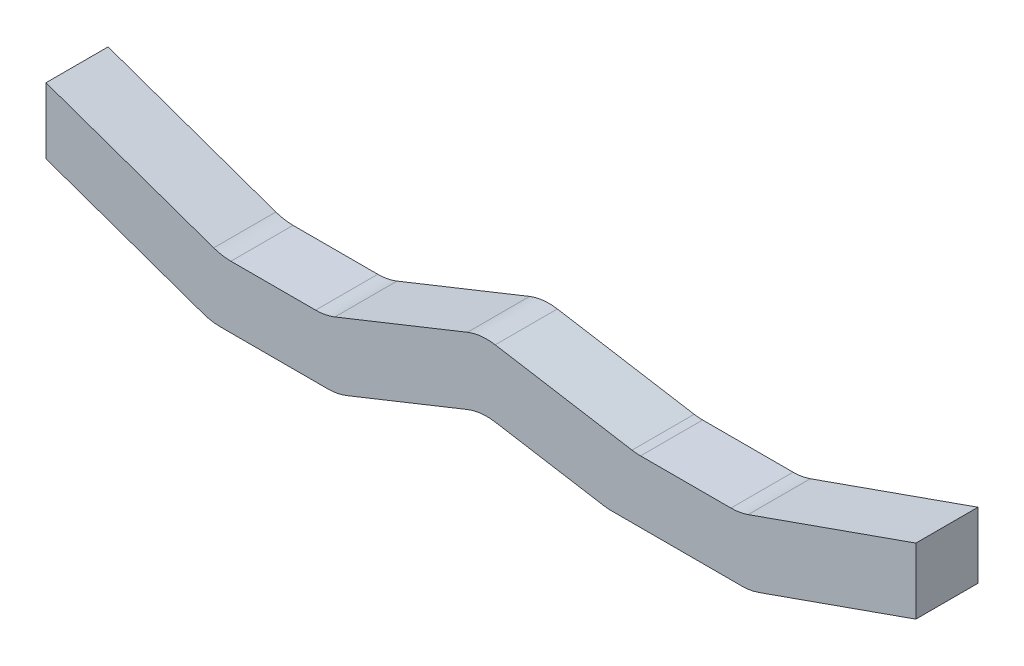
from build123d import *

# Parameters (mm, degrees)
BOSS_EXTRUDE1_DEPTH              = 19.05
F_1_8_0_125_DIAMETER_HOLE1_D     = 3.175
F_1_8_0_125_DIAMETER_HOLE1_DEPTH = 11.1252
F_1_8_0_125_DIAMETER_HOLE1_TIP   = 0.953866233
FILLET1_R                        = 15.875
F_1_8_0_125_DIAMETER_HOLE2_D     = 3.175
F_1_8_0_125_DIAMETER_HOLE2_DEPTH = 11.1252
F_1_8_0_125_DIAMETER_HOLE2_TIP   = 0.953866233
F_1_8_0_125_DIAMETER_HOLE3_D     = 3.175
F_1_8_0_125_DIAMETER_HOLE3_DEPTH = 11.1252
F_1_8_0_125_DIAMETER_HOLE3_TIP   = 0.953866233


with BuildPart() as part:
    # Sketch1 → Boss-Extrude1 (new body)
    with BuildSketch(Plane.XY):
        Polygon((0, 0), (47.625, -7.9375), (79.375, -7.9375), (133.35, 11.1125), (133.35, -9.089191705), (82.638126498, -26.9875), (38.820132509, -26.9875), (0, -20.517477915), (-43.956305212, -38.1), (-82.638126498, -38.1), (-133.35, -20.201691705), (-133.35, 0), (-79.375, -19.05), (-47.625, -19.05), align=None)
    extrude(amount=BOSS_EXTRUDE1_DEPTH)

    # 1/8 (0.125) Diameter Hole1
    with Locations(Plane(origin=(0, 0, 0), x_dir=(-1, 0, 0), z_dir=(0, 0, -1))):
        with Locations((-120.65, -3.470698794), (0, -10.258738958), (120.65, -14.583198794)):
            Hole(F_1_8_0_125_DIAMETER_HOLE1_D / 2, depth=F_1_8_0_125_DIAMETER_HOLE1_DEPTH)
            with Locations((0, 0, -(F_1_8_0_125_DIAMETER_HOLE1_DEPTH + F_1_8_0_125_DIAMETER_HOLE1_TIP / 2))):  # 118° drill point
                Cone(0, F_1_8_0_125_DIAMETER_HOLE1_D / 2, F_1_8_0_125_DIAMETER_HOLE1_TIP, mode=Mode.SUBTRACT)

    # Fillet1
    fillet1_edges = [part.edges().sort_by_distance(p)[0] for p in [
        (0, 0, 9.525),
        (47.625, -7.9375, 9.525),
        (79.375, -7.9375, 9.525),
        (82.638126498, -26.9875, 9.525),
        (38.820132509, -26.9875, 9.525),
        (0, -20.517477915, 9.525),
        (-43.956305212, -38.1, 9.525),
        (-82.638126498, -38.1, 9.525),
        (-79.375, -19.05, 9.525),
        (-47.625, -19.05, 9.525),
    ]]
    fillet(fillet1_edges, radius=FILLET1_R)

    # 1/8 (0.125) Diameter Hole2
    with Locations(Plane(origin=(0, -26.9875, 0), x_dir=(-1, 0, 0), z_dir=(0, -1, 0))):
        with Locations((-73.116041543, -9.525), (-52.478541543, -9.525)):
            Hole(F_1_8_0_125_DIAMETER_HOLE2_D / 2, depth=F_1_8_0_125_DIAMETER_HOLE2_DEPTH)
            with Locations((0, 0, -(F_1_8_0_125_DIAMETER_HOLE2_DEPTH + F_1_8_0_125_DIAMETER_HOLE2_TIP / 2))):  # 118° drill point
                Cone(0, F_1_8_0_125_DIAMETER_HOLE2_D / 2, F_1_8_0_125_DIAMETER_HOLE2_TIP, mode=Mode.SUBTRACT)

    # 1/8 (0.125) Diameter Hole3
    with Locations(Plane(origin=(0, -38.1, 0), x_dir=(-1, 0, 0), z_dir=(0, -1, 0))):
        with Locations((53.350236787, -9.525), (73.987736787, -9.525)):
            Hole(F_1_8_0_125_DIAMETER_HOLE3_D / 2, depth=F_1_8_0_125_DIAMETER_HOLE3_DEPTH)
            with Locations((0, 0, -(F_1_8_0_125_DIAMETER_HOLE3_DEPTH + F_1_8_0_125_DIAMETER_HOLE3_TIP / 2))):  # 118° drill point
                Cone(0, F_1_8_0_125_DIAMETER_HOLE3_D / 2, F_1_8_0_125_DIAMETER_HOLE3_TIP, mode=Mode.SUBTRACT)


solid = part.part
